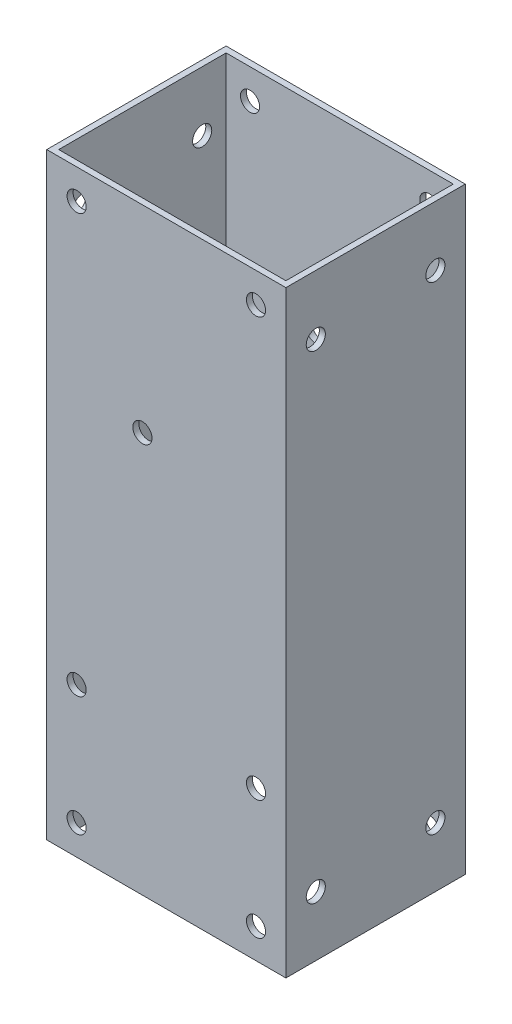
from build123d import *

# Parameters (mm, degrees)
SKETCH_1_W          = 40
SKETCH_1_H          = 30
SKETCH_1_W_2        = 38
SKETCH_1_H_2        = 28
EXTRUDE_1_DEPTH     = 100
SKETCH_2_R          = 1.6
CUT_EXTRUDE_1_DEPTH = 112.803398875
SKETCH_3_R          = 1.6
CUT_EXTRUDE_2_DEPTH = 112.803398875
SKETCH_4_R          = 1.6
CUT_EXTRUDE_3_DEPTH = 112.803398875


with BuildPart() as part:
    # 草图1 → 拉伸-薄壁1 (new body)
    with BuildSketch(Plane(origin=(0, 0, 0), x_dir=(1, 0, 0), z_dir=(0, 1, 0))):
        with Locations((20, 15)):
            Rectangle(SKETCH_1_W, SKETCH_1_H)
        with Locations((20, 15)):
            Rectangle(SKETCH_1_W_2, SKETCH_1_H_2, mode=Mode.SUBTRACT)
    extrude(amount=EXTRUDE_1_DEPTH)

    # 草图2 → 切除-拉伸1 (cut, through all)
    with BuildSketch(Plane.XY):
        with Locations((5, 95)):
            Circle(SKETCH_2_R)
        with Locations((35, 95)):
            Circle(SKETCH_2_R)
        with Locations((35, 25)):
            Circle(SKETCH_2_R)
        with Locations((5, 25)):
            Circle(SKETCH_2_R)
        with Locations((5, 5)):
            Circle(SKETCH_2_R)
        with Locations((35, 5)):
            Circle(SKETCH_2_R)
    extrude(amount=-CUT_EXTRUDE_1_DEPTH, mode=Mode.SUBTRACT)

    # 草图3 → 切除-拉伸2 (cut, through all)
    with BuildSketch(Plane.ZY):
        with Locations((-25, 90)):
            Circle(SKETCH_3_R)
        with Locations((-5, 90)):
            Circle(SKETCH_3_R)
        with Locations((-25, 10)):
            Circle(SKETCH_3_R)
        with Locations((-5, 10)):
            Circle(SKETCH_3_R)
    extrude(amount=-CUT_EXTRUDE_2_DEPTH, mode=Mode.SUBTRACT)

    # 草图4 → 切除-拉伸3 (cut, through all)
    with BuildSketch(Plane.XY):
        with Locations((16, 67)):
            Circle(SKETCH_4_R)
    extrude(amount=-CUT_EXTRUDE_3_DEPTH, mode=Mode.SUBTRACT)


solid = part.part
